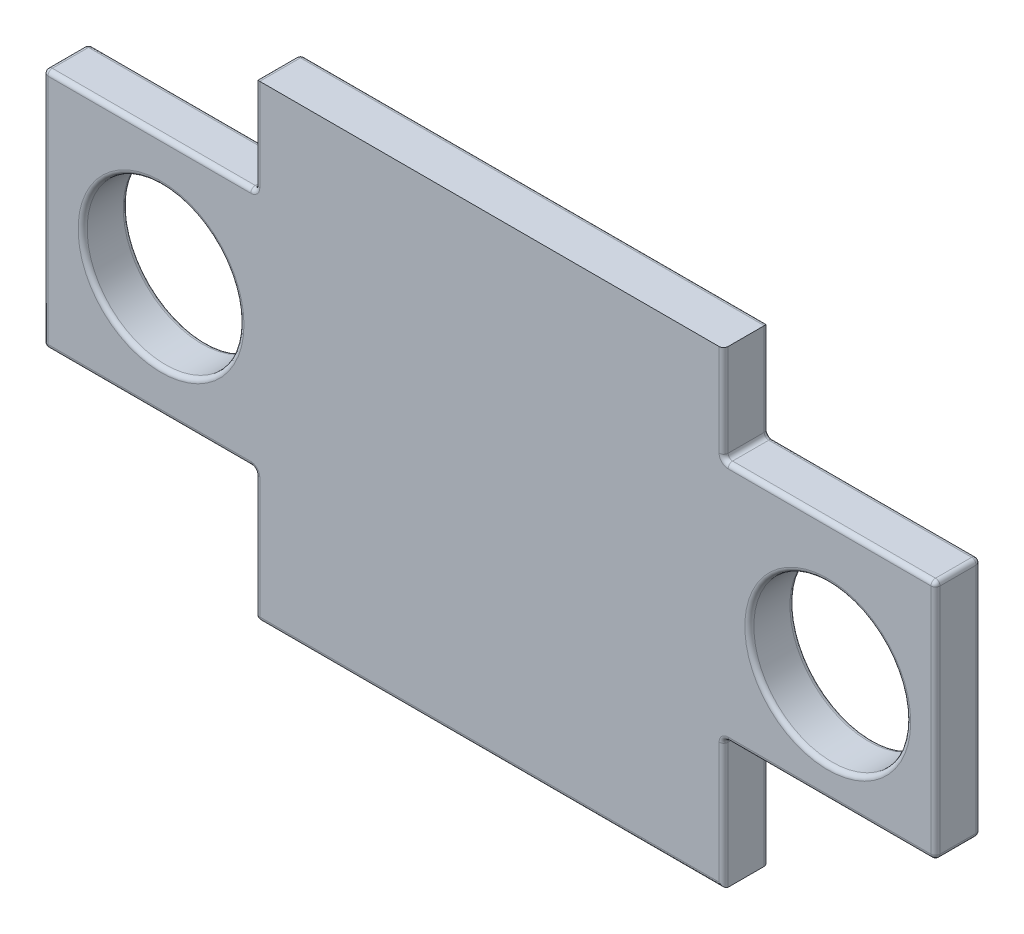
from build123d import *

# Parameters (mm, degrees)
SKETCH2_R             = 3.475
BOSS_EXTRUDE1_DEPTH   = 2
BOSS_EXTRUDE1_2_DEPTH = 2
SKETCH3_W             = 20.75
SKETCH3_H             = 20.75
BOSS_EXTRUDE2_DEPTH   = 2
FILLET1_R             = 0.2


with BuildPart() as part:
    # Sketch2 → Boss-Extrude1 (new body)
    with BuildSketch(Plane.XY):
        with BuildLine():
            Line((-10.375, 6.080549062), (-19.564197283, 6.080549062))
            ThreePointArc((-19.564197283, 6.080549062), (-19.70561864, 6.021970418), (-19.764197283, 5.880549062))
            Line((-19.764197283, 5.880549062), (-19.764197283, -4.408416131))
            ThreePointArc((-19.764197283, -4.408416131), (-19.70561864, -4.549837487), (-19.564197283, -4.608416131))
            Line((-19.564197283, -4.608416131), (-10.375, -4.608416131))
            Line((-10.375, -4.608416131), (-10.375, 6.080549062))
        make_face()
        with Locations((-14.549223744, 0.688062131)):
            Circle(SKETCH2_R, mode=Mode.SUBTRACT)
    extrude(amount=BOSS_EXTRUDE1_DEPTH)



with BuildPart() as body_2:
    # Sketch2 → Boss-Extrude1 2 (new body)
    with BuildSketch(Plane.XY):
        with BuildLine():
            Line((10.375, 6.080549062), (19.564197283, 6.080549062))
            ThreePointArc((19.564197283, 6.080549062), (19.70561864, 6.021970418), (19.764197283, 5.880549062))
            Line((19.764197283, 5.880549062), (19.764197283, -4.408416131))
            ThreePointArc((19.764197283, -4.408416131), (19.70561864, -4.549837487), (19.564197283, -4.608416131))
            Line((19.564197283, -4.608416131), (10.375, -4.608416131))
            Line((10.375, -4.608416131), (10.375, 6.080549062))
        make_face()
        with Locations((14.989443539, 0.208018784)):
            Circle(SKETCH2_R, mode=Mode.SUBTRACT)
    extrude(amount=BOSS_EXTRUDE1_2_DEPTH)


with BuildPart() as part_1:
    add(part.part)

    add(body_2.part)  # Boss-Extrude2 merges body 2
    # Sketch3 → Boss-Extrude2 (add)
    with BuildSketch(Plane.XY.offset(2)):
        Rectangle(SKETCH3_W, SKETCH3_H)
    extrude(amount=-BOSS_EXTRUDE2_DEPTH)

    # Fillet1
    fillet1_edges = [part_1.edges().sort_by_distance(p)[0] for p in [
        (-10.375, -4.608416131, 1),
        (-10.375, 6.080549062, 1),
        (-19.70561864, 6.021970418, 2),
        (-19.764197283, 0.736066465, 2),
        (-18.024223744, 0.688062131, 0),
        (-18.024223744, 0.688062131, 2),
        (-19.70561864, -4.549837487, 2),
        (-14.969598642, -4.608416131, 2),
        (-10.375, 8.227774531, 0),
        (10.375, -7.491708065, 0),
        (0, -10.375, 0),
        (-10.375, -7.491708065, 0),
        (-10.375, -10.375, 1),
        (0, 10.375, 0),
        (-10.375, 10.375, 1),
        (10.375, -7.491708065, 2),
        (-10.375, 8.227774531, 2),
        (-10.375, -7.491708065, 2),
        (0, -10.375, 2),
        (10.375, 8.227774531, 2),
        (10.375, 8.227774531, 0),
        (14.969598642, -4.608416131, 2),
        (19.70561864, -4.549837487, 2),
        (19.764197283, 0.736066465, 2),
        (19.70561864, 6.021970418, 2),
        (14.969598642, 6.080549062, 2),
        (11.514443539, 0.208018784, 0),
        (10.375, 6.080549062, 1),
        (14.969598642, -4.608416131, 0),
        (10.375, -4.608416131, 1),
        (19.70561864, -4.549837487, 0),
        (19.764197283, 0.736066465, 0),
        (19.70561864, 6.021970418, 0),
        (14.969598642, 6.080549062, 0),
        (11.514443539, 0.208018784, 2),
        (-14.969598642, -4.608416131, 0),
        (-19.70561864, -4.549837487, 0),
        (-19.764197283, 0.736066465, 0),
        (-19.70561864, 6.021970418, 0),
        (-14.969598642, 6.080549062, 0),
        (-14.969598642, 6.080549062, 2),
    ]]
    fillet(fillet1_edges, radius=FILLET1_R)


solid = part_1.part
